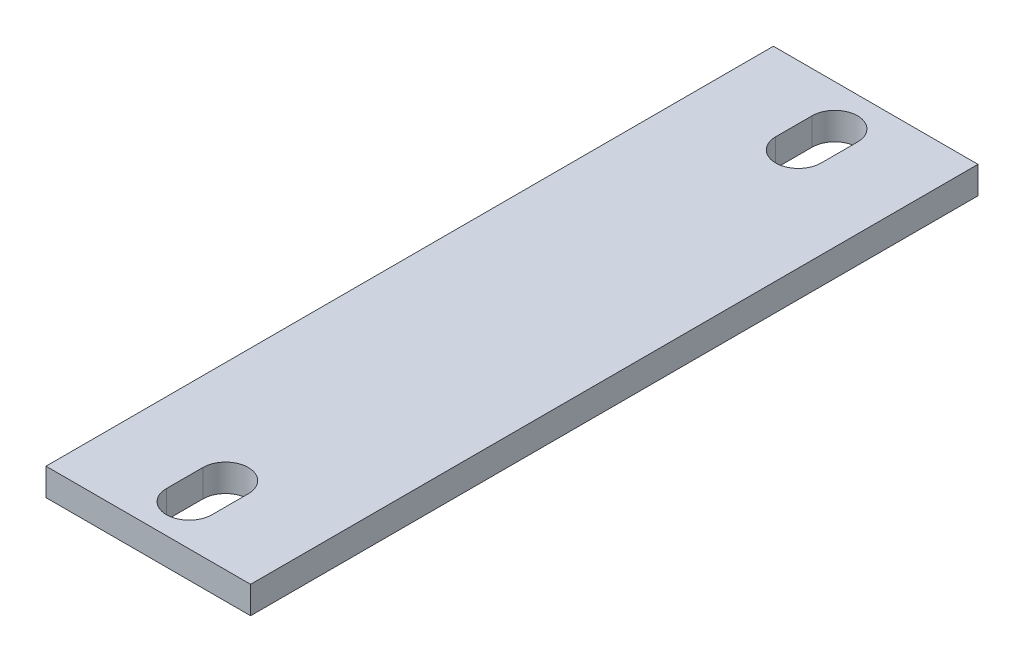
from build123d import *

# Parameters (mm, degrees)
SKETCH_2_W      = 45
SKETCH_2_H      = 160
EXTRUDE_1_DEPTH = 3


with BuildPart() as part:
    # Эскиз2 → Бобышка-Вытянуть1 (new, symmetric)
    with BuildSketch(Plane(origin=(0, 0, 0), x_dir=(1, 0, 0), z_dir=(0, 1, 0))):
        Rectangle(SKETCH_2_W, SKETCH_2_H)
        with BuildLine():
            Line((-5, 63), (-5, 71))
            ThreePointArc((-5, 71), (0, 76), (5, 71))
            Line((5, 71), (5, 63))
            ThreePointArc((5, 63), (0, 58), (-5, 63))
        make_face(mode=Mode.SUBTRACT)
        with BuildLine():
            Line((-5, -63), (-5, -71))
            ThreePointArc((-5, -71), (0, -76), (5, -71))
            Line((5, -71), (5, -63))
            ThreePointArc((5, -63), (0, -58), (-5, -63))
        make_face(mode=Mode.SUBTRACT)
    extrude(amount=EXTRUDE_1_DEPTH, both=True)


solid = part.part
